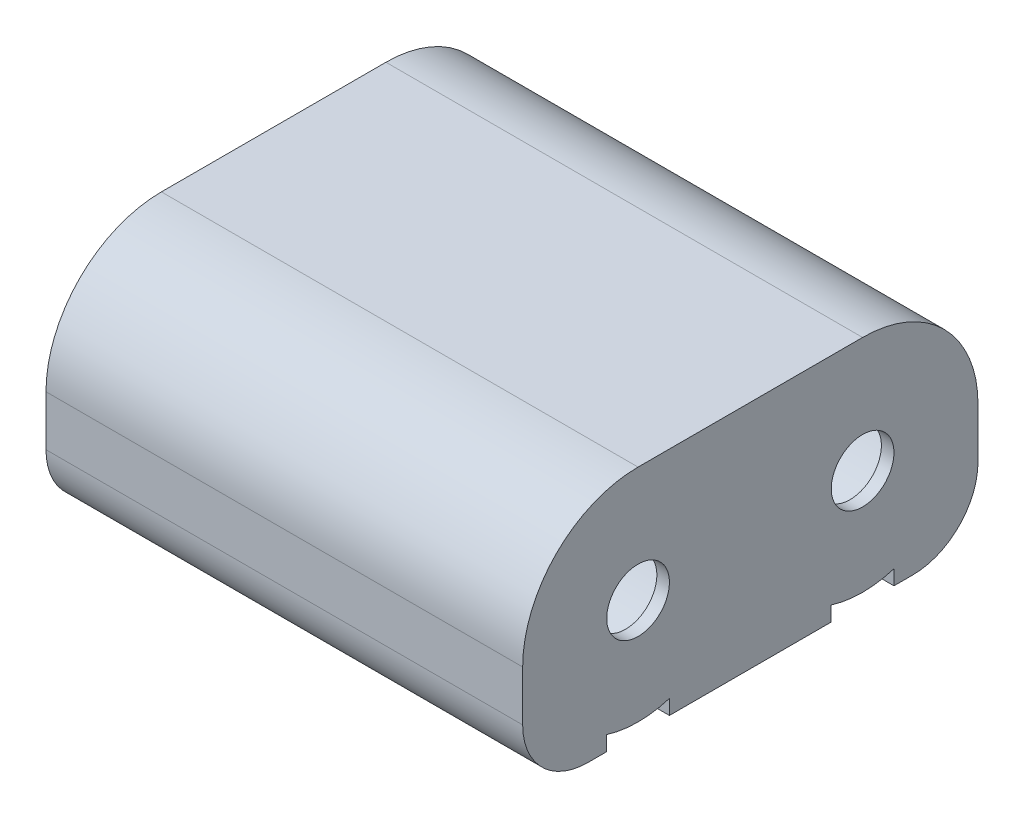
from build123d import *

# Parameters (mm, degrees)
SKETCH_1_R          = 8.4
EXTRUDE_1_DEPTH     = 18.5
EXTRUDE_START       = 1
SKETCH_2_R          = 2.5
EXTRUDE_2_DEPTH     = 1
EXTRUDE_4_DEPTH     = 3
SKETCH_3_R          = 1.5
CUT_EXTRUDE_1_DEPTH = 5
CUT_EXTRUDE_2_DEPTH = 2
CUT_EXTRUDE_3_DEPTH = 3


with BuildPart() as part:
    # Эскиз1 → Бобышка-Вытянуть1 (new, symmetric)
    with BuildSketch(Plane(origin=(0, 0, 0), x_dir=(0, 0, -1), z_dir=(1, 0, 0))):
        with BuildLine():
            Line((-8.95, -9.2), (8.95, -9.2))
            Line((8.95, -9.2), (12.95, -9.2))
            ThreePointArc((12.95, -9.2), (16.626955262, -7.676955262), (18.15, -4))
            Line((18.15, -4), (18.15, 0))
            ThreePointArc((18.15, 0), (15.455382387, 6.505382387), (8.95, 9.2))
            Line((8.95, 9.2), (-8.95, 9.2))
            ThreePointArc((-8.95, 9.2), (-15.455382387, 6.505382387), (-18.15, 0))
            Line((-18.15, 0), (-18.15, -4))
            ThreePointArc((-18.15, -4), (-16.626955262, -7.676955262), (-12.95, -9.2))
            Line((-12.95, -9.2), (-8.95, -9.2))
        make_face()
        with Locations((-8.95, 0)):
            Circle(SKETCH_1_R, mode=Mode.SUBTRACT)
        with Locations((8.95, 0)):
            Circle(SKETCH_1_R, mode=Mode.SUBTRACT)
        with BuildLine():
            Line((-1.93002849, -8.4), (1.93002849, -8.4))
            ThreePointArc((1.93002849, -8.4), (2.858869218, -7.770479287), (2.618260991, -6.674509804))
            ThreePointArc((2.618260991, -6.674509804), (1.659625246, -5.611633981), (0.87745098, -4.412930129))
            ThreePointArc((0.87745098, -4.412930129), (0, -3.892596448), (-0.87745098, -4.412930129))
            ThreePointArc((-0.87745098, -4.412930129), (-1.659625246, -5.611633981), (-2.618260991, -6.674509804))
            ThreePointArc((-2.618260991, -6.674509804), (-2.858869218, -7.770479287), (-1.93002849, -8.4))
        make_face(mode=Mode.SUBTRACT)
        with BuildLine():
            Line((-1.93002849, 8.4), (1.93002849, 8.4))
            ThreePointArc((1.93002849, 8.4), (2.858869218, 7.770479287), (2.618260991, 6.674509804))
            ThreePointArc((2.618260991, 6.674509804), (1.659625246, 5.611633981), (0.87745098, 4.412930129))
            ThreePointArc((0.87745098, 4.412930129), (0, 3.892596448), (-0.87745098, 4.412930129))
            ThreePointArc((-0.87745098, 4.412930129), (-1.659625246, 5.611633981), (-2.618260991, 6.674509804))
            ThreePointArc((-2.618260991, 6.674509804), (-2.858869218, 7.770479287), (-1.93002849, 8.4))
        make_face(mode=Mode.SUBTRACT)
    extrude(amount=EXTRUDE_1_DEPTH, both=True)

    # Эскиз2 → Бобышка-Вытянуть2 (add)
    with BuildSketch(Plane(origin=(18.5, 0, 0), x_dir=(0, 0, -1), z_dir=(1, 0, 0)).offset(EXTRUDE_START)):
        with BuildLine():
            Line((18.15, -4), (18.15, 0))
            ThreePointArc((18.15, 0), (15.455382387, 6.505382387), (8.95, 9.2))
            Line((8.95, 9.2), (-8.95, 9.2))
            ThreePointArc((-8.95, 9.2), (-15.455382387, 6.505382387), (-18.15, 0))
            Line((-18.15, 0), (-18.15, -4))
            ThreePointArc((-18.15, -4), (-16.626955262, -7.676955262), (-12.95, -9.2))
            Line((-12.95, -9.2), (12.95, -9.2))
            ThreePointArc((12.95, -9.2), (16.626955262, -7.676955262), (18.15, -4))
        make_face()
        with Locations((-8.95, 0)):
            Circle(SKETCH_2_R, mode=Mode.SUBTRACT)
        with Locations((8.95, 0)):
            Circle(SKETCH_2_R, mode=Mode.SUBTRACT)
    extrude(amount=-EXTRUDE_2_DEPTH)

    # Эскиз5 → Бобышка-Вытянуть4 (add, symmetric)
    with BuildSketch(Plane(origin=(-10, 0, 0), x_dir=(0, 0, -1), z_dir=(1, 0, 0))):
        with BuildLine():
            Line((-1.93002849, -8.4), (1.93002849, -8.4))
            ThreePointArc((1.93002849, -8.4), (2.858869218, -7.770479287), (2.618260991, -6.674509804))
            ThreePointArc((2.618260991, -6.674509804), (1.659625246, -5.611633981), (0.87745098, -4.412930129))
            ThreePointArc((0.87745098, -4.412930129), (0, -3.892596448), (-0.87745098, -4.412930129))
            ThreePointArc((-0.87745098, -4.412930129), (-1.659625246, -5.611633981), (-2.618260991, -6.674509804))
            ThreePointArc((-2.618260991, -6.674509804), (-2.858869218, -7.770479287), (-1.93002849, -8.4))
        make_face()
    extrude_4 = extrude(amount=EXTRUDE_4_DEPTH, both=True)

    # Зеркальное отражение1: Бобышка-Вытянуть4 across plane
    add(extrude_4.mirror(Plane(origin=(0, 0, 0), x_dir=(0, 0, 1), z_dir=(1, 0, 0))))

    # Эскиз3 → Вырез-Вытянуть1 (cut)
    with BuildSketch(Plane.XZ.offset(9.2)):
        with Locations(Location((-10, 0, 0), (0, 0, 270))):
            Circle(SKETCH_3_R)
        with Locations(Location((10, 0, 0), (0, 0, 90))):
            Circle(SKETCH_3_R)
    extrude(amount=-CUT_EXTRUDE_1_DEPTH, mode=Mode.SUBTRACT)

    # Эскиз6 → Вырез-Вытянуть2 (cut)
    with BuildSketch(Plane.ZY.offset(18.5)):
        with BuildLine():
            Line((11.45, -9.2), (6.45, -9.2))
            Line((6.45, -9.2), (6.45, -8.019351595))
            ThreePointArc((6.45, -8.019351595), (8.95, -8.4), (11.45, -8.019351595))
            Line((11.45, -8.019351595), (11.45, -9.2))
        make_face()
        with BuildLine():
            Line((-6.45, -8.019351595), (-6.45, -9.2))
            Line((-6.45, -9.2), (-11.45, -9.2))
            Line((-11.45, -9.2), (-11.45, -8.019351595))
            ThreePointArc((-11.45, -8.019351595), (-8.95, -8.4), (-6.45, -8.019351595))
        make_face()
    extrude(amount=-CUT_EXTRUDE_2_DEPTH, mode=Mode.SUBTRACT)

    # Эскиз7 → Вырез-Вытянуть3 (cut)
    with BuildSketch(Plane(origin=(19.5, 0, 0), x_dir=(0, 0, -1), z_dir=(1, 0, 0))):
        with BuildLine():
            Line((-6.45, -8.019351595), (-6.45, -9.2))
            Line((-6.45, -9.2), (-11.45, -9.2))
            Line((-11.45, -9.2), (-11.45, -8.019351595))
            ThreePointArc((-11.45, -8.019351595), (-8.95, -8.4), (-6.45, -8.019351595))
        make_face()
        with BuildLine():
            Line((11.45, -9.2), (6.45, -9.2))
            Line((6.45, -9.2), (6.45, -8.019351595))
            ThreePointArc((6.45, -8.019351595), (8.95, -8.4), (11.45, -8.019351595))
            Line((11.45, -8.019351595), (11.45, -9.2))
        make_face()
    extrude(amount=-CUT_EXTRUDE_3_DEPTH, mode=Mode.SUBTRACT)


solid = part.part
